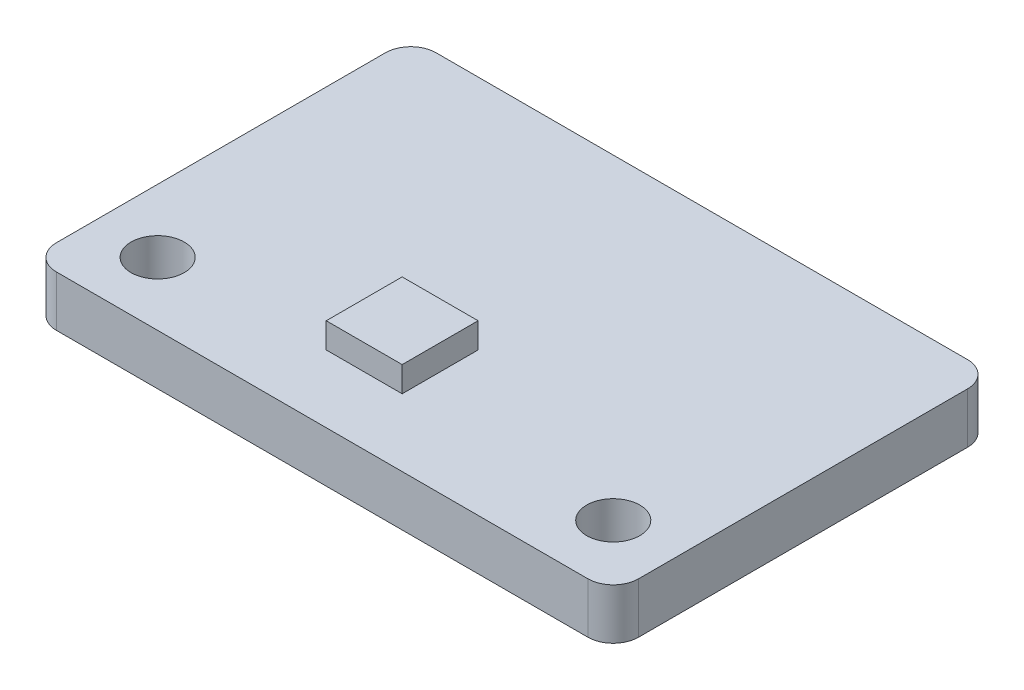
from build123d import *

# Parameters (mm, degrees)
SKETCH_1_R      = 1.05
EXTRUDE_1_DEPTH = 2
SKETCH_2_W      = 3
SKETCH_2_H      = 3
EXTRUDE_2_DEPTH = 1


with BuildPart() as part:
    # 草图1 → 凸台-拉伸1 (new body)
    with BuildSketch(Plane(origin=(0, 0, 0), x_dir=(1, 0, 0), z_dir=(0, 1, 0))):
        with BuildLine():
            Line((1, 0), (22, 0))
            ThreePointArc((22, 0), (22.707106781, 0.292893219), (23, 1))
            Line((23, 1), (23, 14))
            ThreePointArc((23, 14), (22.707106781, 14.707106781), (22, 15))
            Line((22, 15), (1, 15))
            ThreePointArc((1, 15), (0.292893219, 14.707106781), (0, 14))
            Line((0, 14), (0, 1))
            ThreePointArc((0, 1), (0.292893219, 0.292893219), (1, 0))
        make_face()
        with Locations(Location((2.5, 2.5, 0), (0, 0, 270))):
            Circle(SKETCH_1_R, mode=Mode.SUBTRACT)
        with Locations(Location((20.5, 2.5, 0), (0, 0, 90))):
            Circle(SKETCH_1_R, mode=Mode.SUBTRACT)
    extrude(amount=EXTRUDE_1_DEPTH)

    # 草图2 → 凸台-拉伸2 (add)
    with BuildSketch(Plane(origin=(0, 2, 0), x_dir=(1, 0, 0), z_dir=(0, 1, 0))):
        with Locations((10.5, 4.160508355)):
            Rectangle(SKETCH_2_W, SKETCH_2_H)
    extrude(amount=EXTRUDE_2_DEPTH)


solid = part.part
